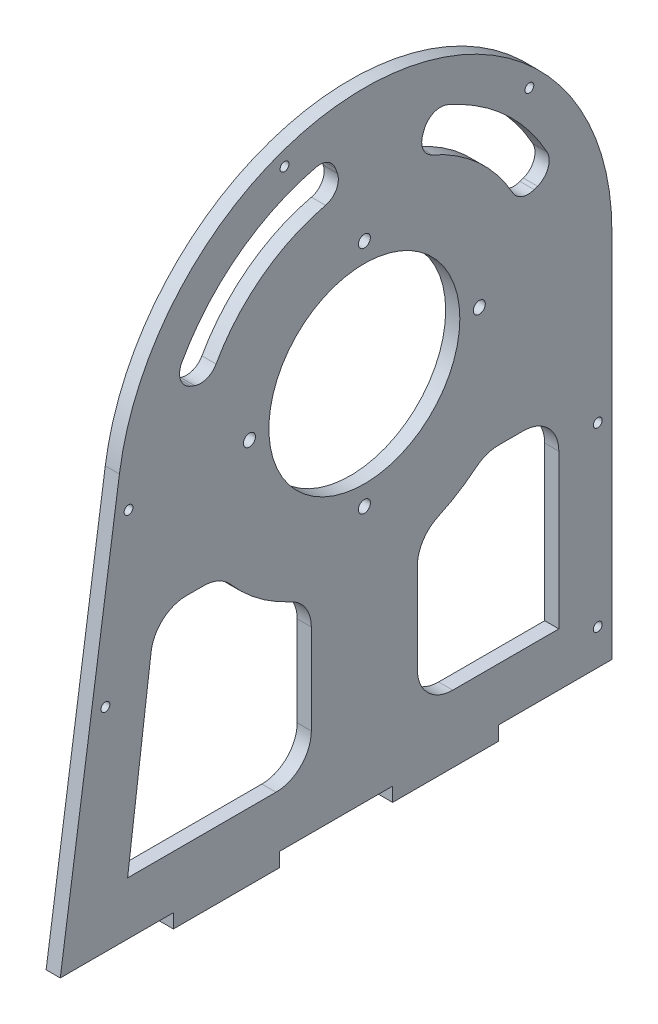
from build123d import *

# Parameters (mm, degrees)
AUFSATZ_LINEAR_AUSTRAGEN3_DEPTH      = 4
SCHNITT_LINEAR_AUSTRAGEN5_DEPTH      = 9.5
SCHNITT_LINEAR_AUSTRAGEN5_DEPTH_BACK = 9.5
SKIZZE2_24_R                         = 27
DURCHGANGSLOCH_F_R_M31_D             = 3.4
DURCHGANGSLOCH_F_R_M31_DEPTH         = 20
DURCHGANGSLOCH_F_R_M31_TIP           = 1.021463052
M3_GEWINDEBOHRUNG1_D                 = 2.5
M3_GEWINDEBOHRUNG1_DEPTH             = 8.5
M3_GEWINDEBOHRUNG1_TIP               = 0.751075774
SCHNITT_LINEAR_AUSTRAGEN6_DEPTH      = 11.5
SCHNITT_LINEAR_AUSTRAGEN7_DEPTH      = 251.552631004
SKIZZE13_W                           = 4
SKIZZE13_H                           = 30
AUFSATZ_LINEAR_AUSTRAGEN4_DEPTH      = 4


with BuildPart() as part:
    # Skizze2 → Aufsatz-Linear austragen3 (new body)
    with BuildSketch(Plane(origin=(0, 0, 0), x_dir=(0, 0, -1), z_dir=(1, 0, 0))):
        with BuildLine():
            Line((-10.496092502, -82.188867417), (-10.496092502, -187.188867417))
            Line((-10.496092502, -187.188867417), (-166.496092502, -187.188867417))
            Line((-166.496092502, -187.188867417), (-149.76794454, -72.118588605))
            ThreePointArc((-149.76794454, -72.118588605), (-75.447807774, -12.371141721), (-10.496092502, -82.188867417))
        make_face()
    extrude(amount=AUFSATZ_LINEAR_AUSTRAGEN3_DEPTH)

    # Skizze2<24> → Schnitt-Linear austragen5 (cut, two sides: drawn at the far end of the back side and taken through both)
    with BuildSketch(Plane(origin=(0, 0, 0), x_dir=(0, 0, -1), z_dir=(1, 0, 0)).offset(-SCHNITT_LINEAR_AUSTRAGEN5_DEPTH_BACK)):
        with Locations((-80.496092502, -82.188867417)):
            Circle(SKIZZE2_24_R)
    extrude(amount=SCHNITT_LINEAR_AUSTRAGEN5_DEPTH + SCHNITT_LINEAR_AUSTRAGEN5_DEPTH_BACK, mode=Mode.SUBTRACT)

    # Durchgangsloch für M31
    with Locations(Plane.ZY):
        with Locations((47.996092502, -82.188867417), (80.496092502, -49.688867417), (112.996092502, -82.188867417), (80.496092502, -114.688867417)):
            Hole(DURCHGANGSLOCH_F_R_M31_D / 2, depth=DURCHGANGSLOCH_F_R_M31_DEPTH)
            with Locations((0, 0, -(DURCHGANGSLOCH_F_R_M31_DEPTH + DURCHGANGSLOCH_F_R_M31_TIP / 2))):  # 118° drill point
                Cone(0, DURCHGANGSLOCH_F_R_M31_D / 2, DURCHGANGSLOCH_F_R_M31_TIP, mode=Mode.SUBTRACT)

    # M3 Gewindebohrung1
    with Locations(Plane.ZY):
        with Locations((33.827044944, -35.519819858), (103.069421962, -20.169154445), (14.496092502, -127.188867417), (14.496092502, -177.188867417), (147.189848539, -82.188867417), (153.731647743, -127.188867417)):
            Hole(M3_GEWINDEBOHRUNG1_D / 2, depth=M3_GEWINDEBOHRUNG1_DEPTH)
            with Locations((0, 0, -(M3_GEWINDEBOHRUNG1_DEPTH + M3_GEWINDEBOHRUNG1_TIP / 2))):  # 118° drill point
                Cone(0, M3_GEWINDEBOHRUNG1_D / 2, M3_GEWINDEBOHRUNG1_TIP, mode=Mode.SUBTRACT)

    # Skizze2<28> → Schnitt-Linear austragen6 (cut)
    with BuildSketch(Plane(origin=(0, 0, 0), x_dir=(0, 0, -1), z_dir=(1, 0, 0))):
        with BuildLine():
            Line((-25.496092502, -172.188916155), (-55.496092502, -172.188916155))
            ThreePointArc((-55.496092502, -172.188916155), (-62.567160314, -169.259983967), (-65.496092502, -162.188916155))
            Line((-65.496092502, -162.188916155), (-65.496092502, -146.461723273))
            Line((-65.496092502, -146.461723273), (-65.496092502, -136.73242799))
            ThreePointArc((-65.496092502, -136.73242799), (-63.912346618, -131.331810741), (-59.662759169, -127.641834561))
            ThreePointArc((-59.662759169, -127.641834561), (-54.057449416, -124.627035988), (-48.880535655, -120.924594661))
            ThreePointArc((-48.880535655, -120.924594661), (-45.913653233, -119.251775819), (-42.557424285, -118.67174011))
            Line((-42.557424285, -118.67174011), (-35.496092502, -118.67174011))
            ThreePointArc((-35.496092502, -118.67174011), (-28.425024691, -121.600672299), (-25.496092502, -128.67174011))
            Line((-25.496092502, -128.67174011), (-25.496092502, -172.188916155))
        make_face()
        with BuildLine():
            Line((-130.877768415, -111.399148996), (-125.911440332, -111.399148996))
            ThreePointArc((-125.911440332, -111.399148996), (-121.749137442, -112.3065567), (-118.342215694, -114.864102066))
            ThreePointArc((-118.342215694, -114.864102066), (-110.523367877, -122.168396348), (-101.329425836, -127.641834561))
            ThreePointArc((-101.329425836, -127.641834561), (-97.079838387, -131.331810741), (-95.496092502, -136.73242799))
            Line((-95.496092502, -136.73242799), (-95.496092502, -146.461723273))
            Line((-95.496092502, -146.461723273), (-95.496092502, -162.188916155))
            ThreePointArc((-95.496092502, -162.188916155), (-98.425024691, -169.259983967), (-105.496092502, -172.188916155))
            Line((-105.496092502, -172.188916155), (-135.495711073, -172.188916155))
            Line((-135.495711073, -172.188916155), (-147.455367056, -172.188916155))
            Line((-147.455367056, -172.188916155), (-140.79696332, -120.130459738))
            ThreePointArc((-140.79696332, -120.130459738), (-137.485079041, -113.892921828), (-130.877768415, -111.399148996))
        make_face()
    extrude(amount=SCHNITT_LINEAR_AUSTRAGEN6_DEPTH, mode=Mode.SUBTRACT)

    # Skizze12 → Schnitt-Linear austragen7 (cut, through all)
    with BuildSketch(Plane(origin=(0, 0, 0), x_dir=(0, -1, 0), z_dir=(-1, 0, 0))):
        with BuildLine():
            Line((31.912537744, 63.973777934), (30.971018966, 63.631093123))
            ThreePointArc((30.971018966, 63.631093123), (28.08654575, 60.904910522), (28.097068966, 56.936013123))
            ThreePointArc((28.097068966, 56.936013123), (38.550531474, 40.788465575), (53.642597032, 28.861700406))
            ThreePointArc((53.642597032, 28.861700406), (57.815417493, 28.555111356), (60.760235592, 31.52739563))
            Line((60.760235592, 31.52739563), (61.10653899, 32.478856395))
            ThreePointArc((61.10653899, 32.478856395), (61.093057729, 35.935652601), (58.840226031, 38.55755479))
            ThreePointArc((58.840226031, 38.55755479), (46.6574065, 48.223576562), (38.204358174, 61.277274988))
            ThreePointArc((38.204358174, 61.277274988), (35.592240185, 63.871037738), (31.912537744, 63.973777934))
        make_face()
        with BuildLine():
            Line((29.286912013, 88.138295897), (27.761021392, 88.693674664))
            ThreePointArc((27.761021392, 88.693674664), (25.233242691, 90.879922217), (24.8009776, 94.193906286))
            ThreePointArc((24.8009776, 94.193906286), (35.221155466, 116.203711215), (53.642597032, 132.130484599))
            ThreePointArc((53.642597032, 132.130484599), (57.815417493, 132.437073649), (60.760235592, 129.464789375))
            Line((60.760235592, 129.464789375), (61.10653899, 128.51332861))
            ThreePointArc((61.10653899, 128.51332861), (61.093057729, 125.056532404), (58.840226031, 122.434630215))
            ThreePointArc((58.840226031, 122.434630215), (43.883689457, 109.422090178), (35.461380891, 91.475254721))
            ThreePointArc((35.461380891, 91.475254721), (33.123794278, 88.419680828), (29.286912013, 88.138295897))
        make_face()
    extrude(amount=-SCHNITT_LINEAR_AUSTRAGEN7_DEPTH, mode=Mode.SUBTRACT)


with BuildPart() as body_2:
    # Spiegeln1: mirrored copy
    add(part.part.mirror(Plane(origin=(4, -82.188867417, 80.496092502), x_dir=(0, 0, 1), z_dir=(1, 0, 0))))

    # Skizze13 → Aufsatz-Linear austragen4 (add)
    with BuildSketch(Plane.XZ.offset(187.188867417)):
        with Locations((6, 57.496092502)):
            Rectangle(SKIZZE13_W, SKIZZE13_H)
        with Locations((6, 119.496092502)):
            Rectangle(SKIZZE13_W, SKIZZE13_H)
    extrude(amount=AUFSATZ_LINEAR_AUSTRAGEN4_DEPTH)


solid = body_2.part
